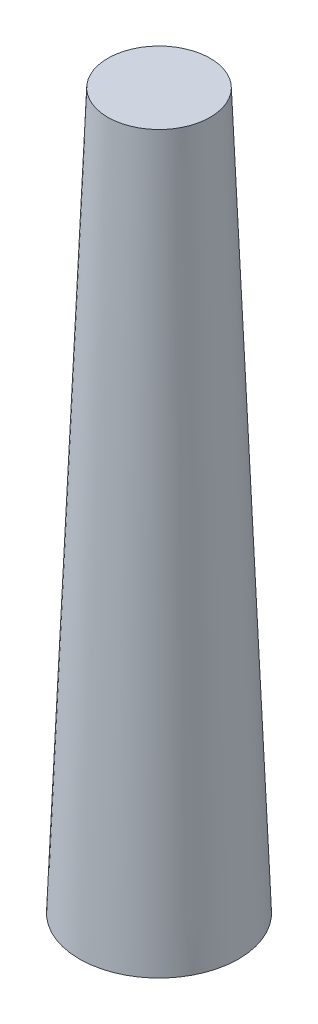
from build123d import *

# Parameters (mm, degrees)
SKETCH2_R = 1.20015
SKETCH1_R = 1.8669


with BuildPart() as part:
    # Sketch2 → Loft1 section 0
    with BuildSketch(Plane(origin=(0, 16.764, 0), x_dir=(1, 0, 0), z_dir=(0, 1, 0))):
        Circle(SKETCH2_R)
    # Sketch1 → Loft1 section 1
    with BuildSketch(Plane(origin=(0, 0, 0), x_dir=(1, 0, 0), z_dir=(0, 1, 0))):
        Circle(SKETCH1_R)
    loft()


solid = part.part
